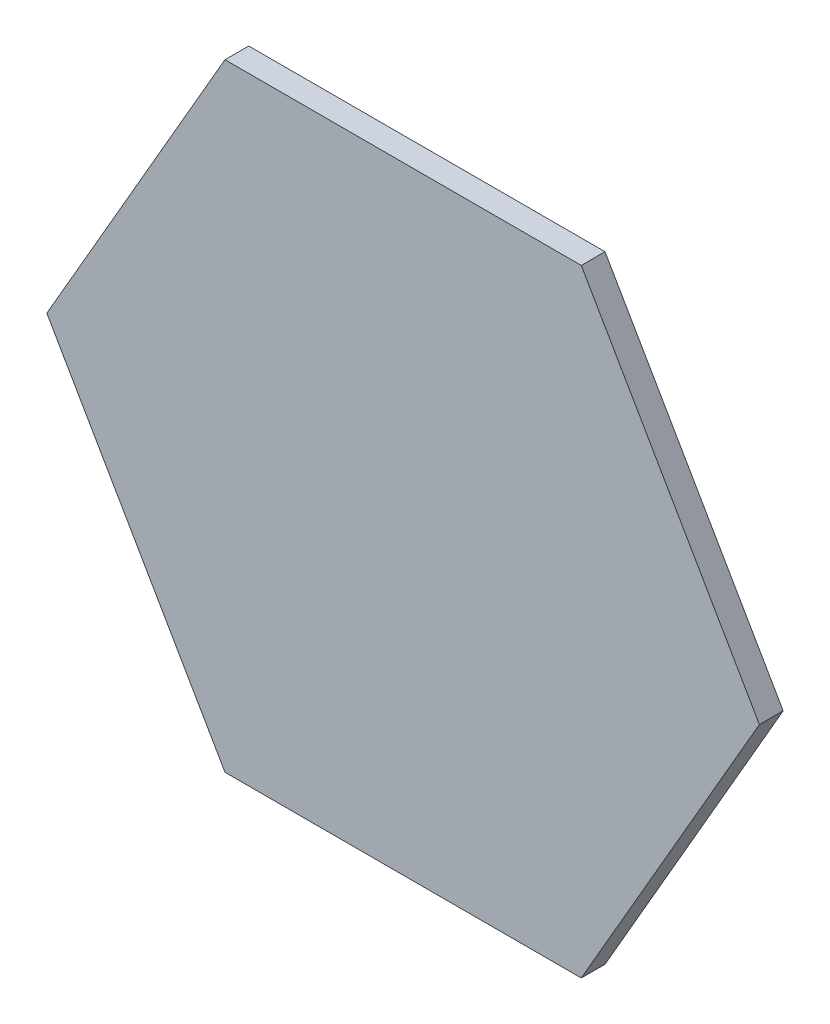
from build123d import *

# Parameters (mm, degrees)
BOSS_EXTRUDE1_DEPTH = 10


with BuildPart() as part:
    # Sketch1 → Boss-Extrude1 (new body)
    with BuildSketch(Plane.XY):
        Polygon((75, 129.903810568), (-75, 129.903810568), (-150, 0), (-75, -129.903810568), (75, -129.903810568), (150, 0), align=None)
    extrude(amount=BOSS_EXTRUDE1_DEPTH)


solid = part.part
